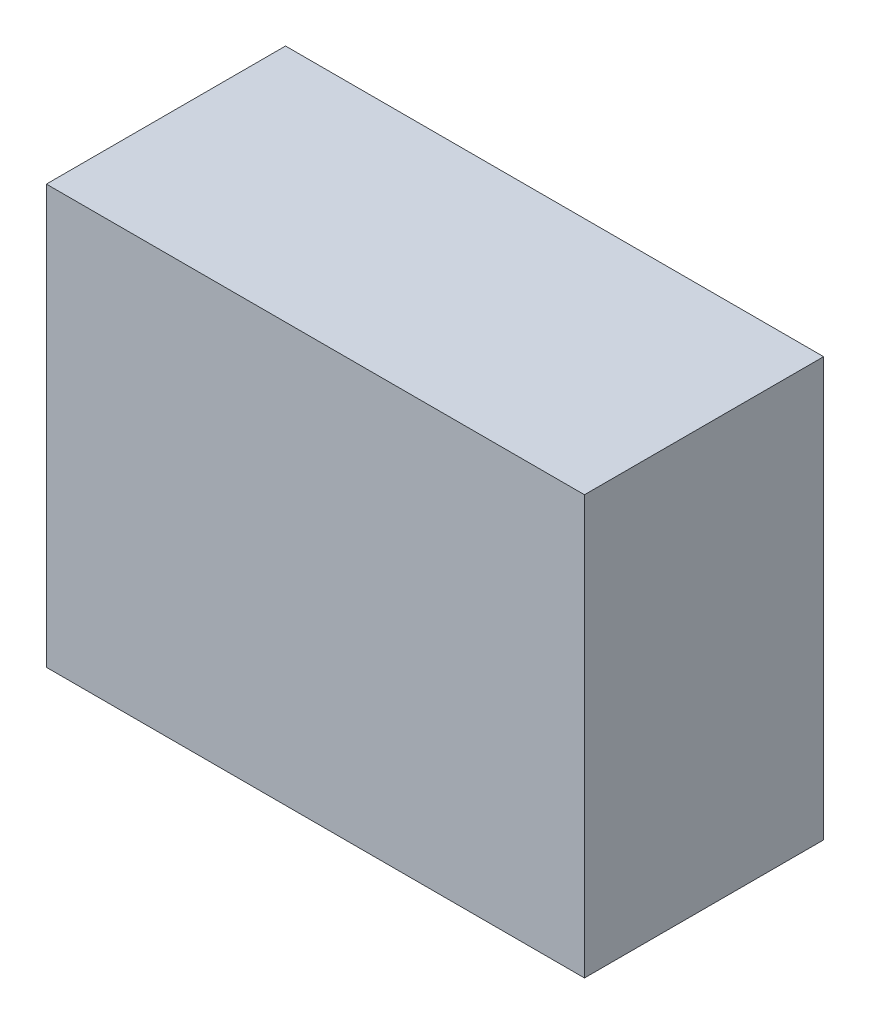
from build123d import *

# Parameters (mm, degrees)
SKETCH1_W           = 457.2
SKETCH1_H           = 355.6
BOSS_EXTRUDE1_DEPTH = 203.2


with BuildPart() as part:
    # Sketch1 → Boss-Extrude1 (new body)
    with BuildSketch(Plane.XY):
        Rectangle(SKETCH1_W, SKETCH1_H)
    extrude(amount=BOSS_EXTRUDE1_DEPTH)


solid = part.part
